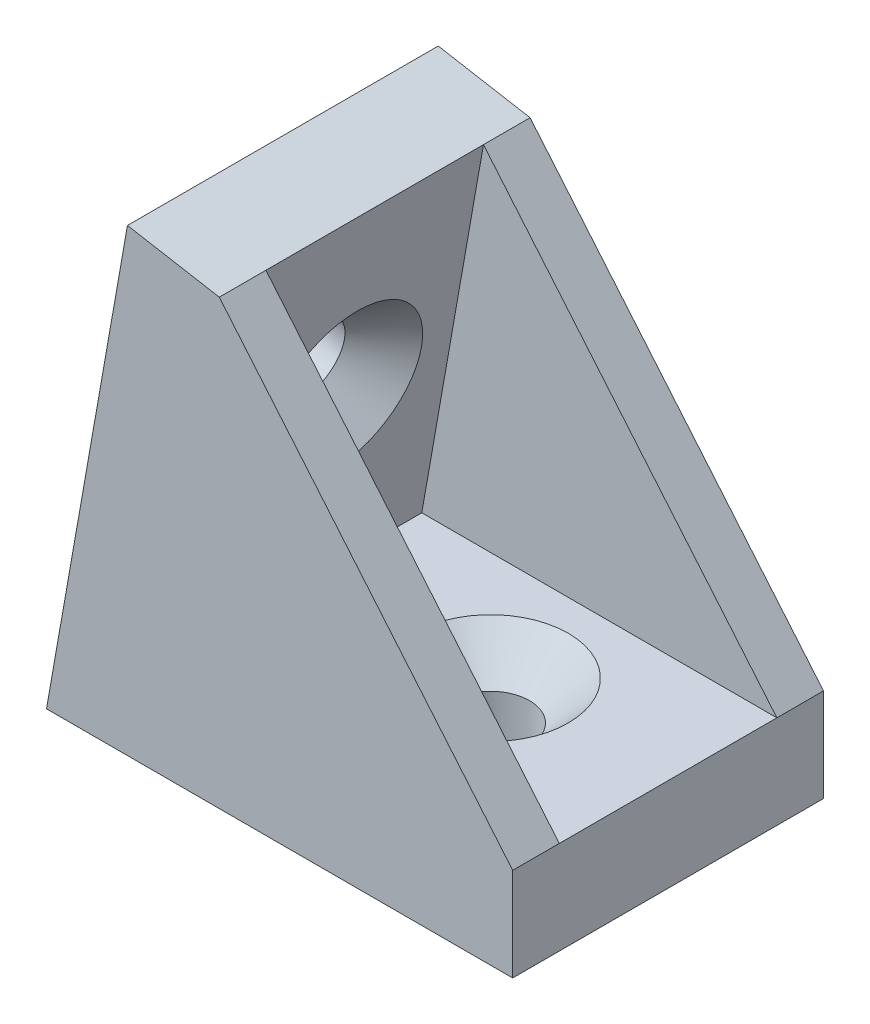
from build123d import *

# Parameters (mm, degrees)
BOSS_EXTRUDE1_DEPTH = 10
BOSS_EXTRUDE2_DEPTH = 3
SKETCH3_R           = 2.5
CUT_EXTRUDE1_DEPTH  = 41.198190433
SKETCH4_R           = 2.5
CUT_EXTRUDE2_DEPTH  = 40.425003339
CHAMFER1_SIZE       = 2.5


with BuildPart() as part:
    # Sketch1 → Boss-Extrude1 (new, symmetric)
    with BuildSketch(Plane.XY):
        Polygon((0, 0), (5.20944533, 29.54423259), (11.118291848, 28.502343524), (7.150521556, 6), (30, 6), (30, 0), align=None)
    extrude(amount=BOSS_EXTRUDE1_DEPTH, both=True)

    # Sketch2 → Boss-Extrude2 (add)
    with BuildSketch(Plane.XY.offset(10)):
        Polygon((11.118291848, 28.502343524), (7.150521556, 6), (30, 6), align=None)
    boss_extrude2 = extrude(amount=-BOSS_EXTRUDE2_DEPTH)

    # Mirror1: Boss-Extrude2 across plane
    add(boss_extrude2.mirror(Plane.XY))

    # Sketch3 → Cut-Extrude1 (cut, through all)
    with BuildSketch(Plane(origin=(5.908846518, -1.041889066, 0), x_dir=(0, 0, -1), z_dir=(0.9848077530122076, -0.173648177666934, 0))):
        with Locations(Location((0, 18.575260778, 0), (0, 0, 90))):
            Circle(SKETCH3_R)
    extrude(amount=-CUT_EXTRUDE1_DEPTH, mode=Mode.SUBTRACT)

    # Sketch4 → Cut-Extrude2 (cut, through all)
    with BuildSketch(Plane(origin=(0, 6, 0), x_dir=(1, 0, 0), z_dir=(0, 1, 0))):
        with Locations(Location((18.575260778, 0, 0), (0, 0, 270))):
            Circle(SKETCH4_R)
    extrude(amount=-CUT_EXTRUDE2_DEPTH, mode=Mode.SUBTRACT)

    # Chamfer1
    chamfer1_edges = [part.edges().sort_by_distance(p)[0] for p in [
        (8.700286258, 14.78915238, 0),
        (18.575260778, 6, -2.5),
    ]]
    chamfer(chamfer1_edges, length=CHAMFER1_SIZE)


solid = part.part
